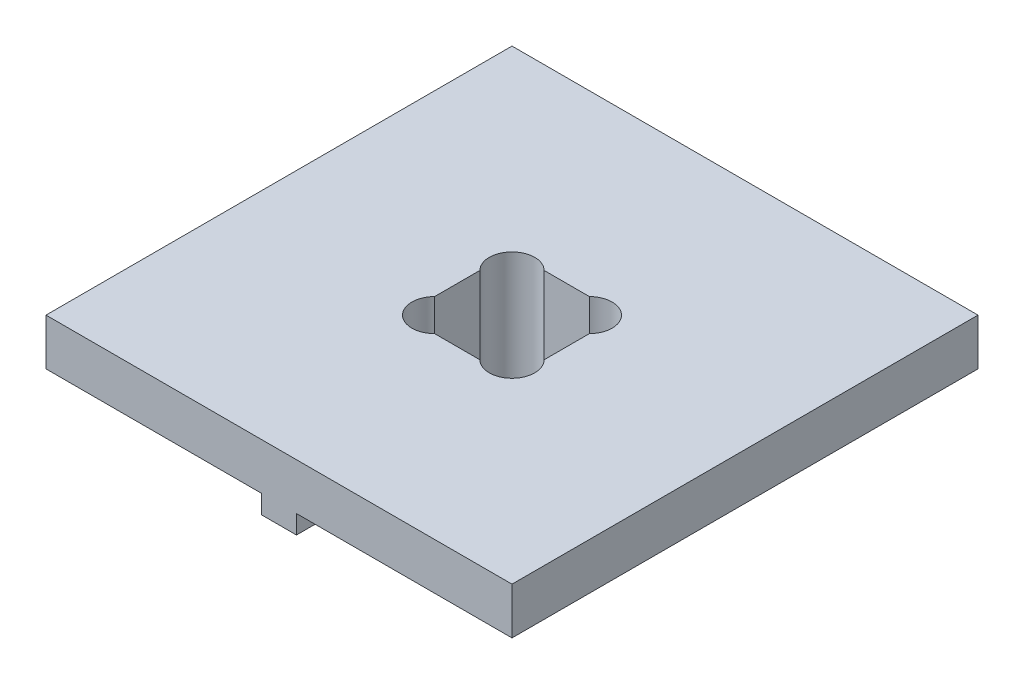
from build123d import *

# Parameters (mm, degrees)
SKETCH1_W               = 25.4
SKETCH1_H               = 25.4
SKETCH1_W_2             = 5.969
SKETCH1_H_2             = 5.969
BOSS_EXTRUDE1_DEPTH     = 10.16
SKETCH2_W               = 1.905
SKETCH2_H               = 9.7155
BOSS_EXTRUDE2_DEPTH     = 1.016
SKETCH3_W               = 9.4488
SKETCH3_H               = 9.4488
SKETCH3_W_2             = 5.969
SKETCH3_H_2             = 5.969
BOSS_EXTRUDE3_DEPTH     = 6
CUT_EXTRUDE2_REACH      = 22.635
SKETCH4_W               = 1.905
SKETCH4_H               = 4.1656
SKETCH7_R               = 1.237436867
CUT_EXTRUDE5_DEPTH      = 25.160413904
MIRROR4_COPY_1_SKETCH_R = 1.237436867
MIRROR4_COPY_1_DEPTH    = 25.160413904
SKETCH6_W               = 25.4
SKETCH6_H               = 25.4
CUT_EXTRUDE4_DEPTH      = 7.62
FILLET1_R               = 1.778


with BuildPart() as part:
    # Sketch1 → Boss-Extrude1 (new body)
    with BuildSketch(Plane(origin=(0, 0, 0), x_dir=(1, 0, 0), z_dir=(0, 1, 0))):
        Rectangle(SKETCH1_W, SKETCH1_H)
        Rectangle(SKETCH1_W_2, SKETCH1_H_2, mode=Mode.SUBTRACT)
    extrude(amount=BOSS_EXTRUDE1_DEPTH)

    # Sketch2 → Boss-Extrude2 (add)
    with BuildSketch(Plane.XZ):
        with Locations((0, 7.84225)):
            Rectangle(SKETCH2_W, SKETCH2_H)
    boss_extrude2 = extrude(amount=BOSS_EXTRUDE2_DEPTH)

    # Mirror1: Boss-Extrude2 across plane
    add(boss_extrude2.mirror(Plane.XY))

    # Sketch3 → Boss-Extrude3 (add)
    with BuildSketch(Plane.XZ):
        Rectangle(SKETCH3_W, SKETCH3_H)
        Rectangle(SKETCH3_W_2, SKETCH3_H_2, mode=Mode.SUBTRACT)
    extrude(amount=BOSS_EXTRUDE3_DEPTH)

    # Sketch4 → Cut-Extrude2 (cut, up to next)
    with BuildSketch(Plane.XZ, mode=Mode.PRIVATE) as cut_extrude2_sk1:
        with Locations((0, 6.8072)):
            Rectangle(SKETCH4_W, SKETCH4_H)
    cut_extrude2_tool1 = extrude(cut_extrude2_sk1.sketch, amount=CUT_EXTRUDE2_REACH, mode=Mode.PRIVATE) & part.part
    # Sketch4 → Cut-Extrude2 (cut, up to next)
    with BuildSketch(Plane.XZ, mode=Mode.PRIVATE) as cut_extrude2_sk2:
        with Locations((0, -6.8072)):
            Rectangle(SKETCH4_W, SKETCH4_H)
    cut_extrude2_tool2 = extrude(cut_extrude2_sk2.sketch, amount=CUT_EXTRUDE2_REACH, mode=Mode.PRIVATE) & part.part
    add(cut_extrude2_tool1.solids().sort_by_distance((0, 0, 6.8072))[0], mode=Mode.SUBTRACT)
    add(cut_extrude2_tool2.solids().sort_by_distance((0, 0, -6.8072))[0], mode=Mode.SUBTRACT)

    # Sketch7 → Cut-Extrude5 (cut, through all)
    with BuildSketch(Plane.XZ.offset(6)):
        with Locations((-2.1095, 2.1095)):
            Circle(SKETCH7_R)
    cut_extrude5 = extrude(amount=-CUT_EXTRUDE5_DEPTH, mode=Mode.SUBTRACT)

    # Mirror3: Cut-Extrude5 across plane
    add(cut_extrude5.mirror(Plane(origin=(0, 0, 0), x_dir=(0, 0, 1), z_dir=(1, 0, 0))), mode=Mode.SUBTRACT)

    # Mirror4: Cut-Extrude5 across plane
    add(cut_extrude5.mirror(Plane.XY), mode=Mode.SUBTRACT)

    # Mirror4 copy 1 sketch → Mirror4 copy 1 (cut, through all)
    with BuildSketch(Plane(origin=(0, -6, 0), x_dir=(-1, 0, 0), z_dir=(0, -1, 0))):
        with Locations((-2.1095, 2.1095)):
            Circle(MIRROR4_COPY_1_SKETCH_R)
    extrude(amount=-MIRROR4_COPY_1_DEPTH, mode=Mode.SUBTRACT)

    # Sketch6 → Cut-Extrude4 (cut)
    with BuildSketch(Plane(origin=(0, 10.16, 0), x_dir=(1, 0, 0), z_dir=(0, 1, 0))):
        Rectangle(SKETCH6_W, SKETCH6_H)
    extrude(amount=-CUT_EXTRUDE4_DEPTH, mode=Mode.SUBTRACT)

    # Fillet1
    fillet1_edges = [part.edges().sort_by_distance(p)[0] for p in [
        (4.7244, -3, 4.7244),
        (-4.7244, -3, 4.7244),
        (-4.7244, -3, -4.7244),
        (4.7244, -3, -4.7244),
    ]]
    fillet(fillet1_edges, radius=FILLET1_R)


solid = part.part
